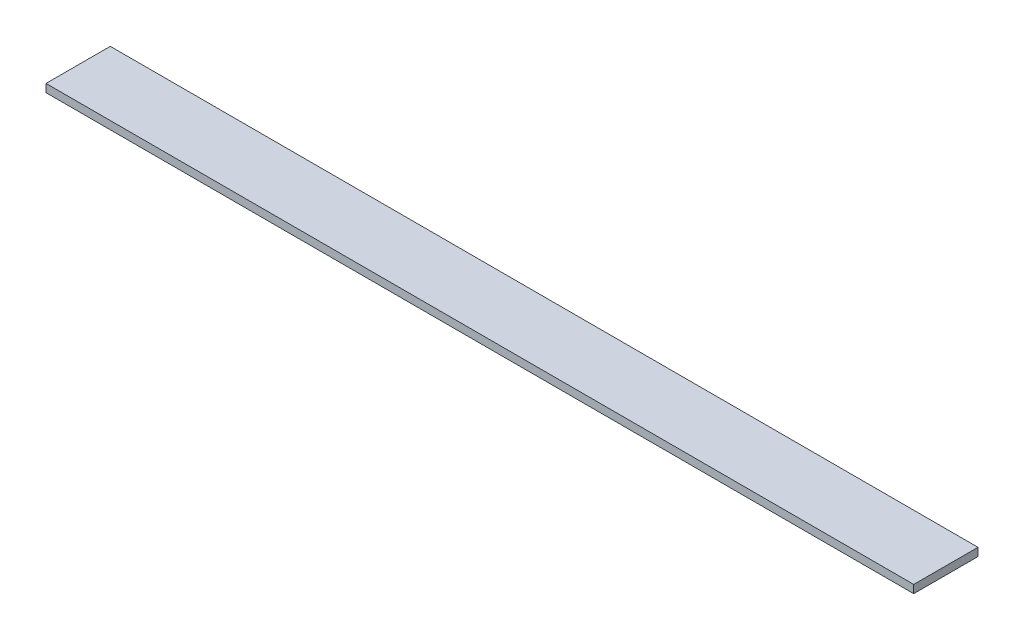
from build123d import *

# Parameters (mm, degrees)
SKETCH1_W           = 108
SKETCH1_H           = 8
BOSS_EXTRUDE1_DEPTH = 1


with BuildPart() as part:
    # Sketch1 → Boss-Extrude1 (new body)
    with BuildSketch(Plane(origin=(0, 0, 0), x_dir=(1, 0, 0), z_dir=(0, 1, 0))):
        with Locations((-20.763636364, -2.872727273)):
            Rectangle(SKETCH1_W, SKETCH1_H)
    extrude(amount=BOSS_EXTRUDE1_DEPTH)


solid = part.part
